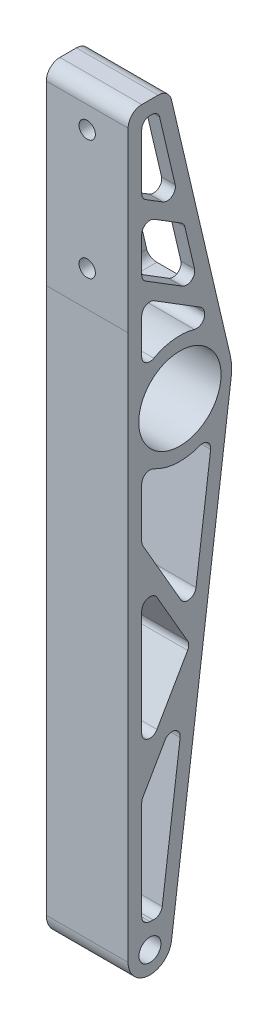
from build123d import *

# Parameters (mm, degrees)
BOSS_EXTRUDE1_DEPTH      = 15
BOSS_EXTRUDE1_DEPTH_BACK = 15
SKETCH1_R                = 4.05
SKETCH1_R_2              = 15.1
CUT_EXTRUDE2_DEPTH       = 10
CUT_EXTRUDE2_DEPTH_BACK  = 10
SKETCH5_W                = 66.834238055
SKETCH5_H                = 69.856255641
CUT_EXTRUDE1_DEPTH       = 274.313007374
CUT_EXTRUDE1_DEPTH_BACK  = 274.313007374
FILLET1_R                = 3
FILLET2_R                = 5
SKETCH6_R                = 3
CUT_EXTRUDE3_DEPTH       = 5


with BuildPart() as part:
    # Sketch1 → Boss-Extrude1 (new, two sides: drawn at the far end of the back side and taken through both)
    with BuildSketch(Plane(origin=(0, 0, 0), x_dir=(0, 0, -1), z_dir=(1, 0, 0)).offset(-BOSS_EXTRUDE1_DEPTH_BACK)):
        with BuildLine():
            Line((-8, 0), (-8, 270))
            Line((-8, 270), (7, 270))
            Line((7, 270), (29.498971947, 173.978261275))
            ThreePointArc((29.498971947, 173.978261275), (29.975942027, 170.599581269), (29.840899654, 167.190073592))
            Line((29.840899654, 167.190073592), (7.933010381, -1.033124533))
            ThreePointArc((7.933010381, -1.033124533), (-0.517647059, -7.983235029), (-8, 0))
        make_face()
        Circle(SKETCH1_R, mode=Mode.SUBTRACT)
        with Locations((11, 169.643744359)):
            Circle(SKETCH1_R_2, mode=Mode.SUBTRACT)
    extrude(amount=BOSS_EXTRUDE1_DEPTH + BOSS_EXTRUDE1_DEPTH_BACK)

    # Sketch5 → Cut-Extrude2 (cut, two sides: drawn at the far end of the back side and taken through both)
    with BuildSketch(Plane(origin=(0, 0, 0), x_dir=(0, 0, -1), z_dir=(1, 0, 0)).offset(-CUT_EXTRUDE2_DEPTH_BACK)):
        with Locations((30.417119028, 230.07187218)):
            Rectangle(SKETCH5_W, SKETCH5_H)
    extrude(amount=CUT_EXTRUDE2_DEPTH + CUT_EXTRUDE2_DEPTH_BACK, mode=Mode.SUBTRACT)

    # Sketch4 → Cut-Extrude1 (cut, two sides: drawn at the far end of the back side and taken through both)
    with BuildSketch(Plane(origin=(15, 0, 0), x_dir=(0, 0, -1), z_dir=(1, 0, 0)).offset(-CUT_EXTRUDE1_DEPTH_BACK)):
        with BuildLine():
            ThreePointArc((23.038271938, 153.672519962), (9.705882353, 149.685656787), (-3, 155.360887501))
            Line((-3, 155.360887501), (-3, 130.360887501))
            Line((-3, 130.360887501), (15.768762187, 97.852437799))
            Line((15.768762187, 97.852437799), (23.038271938, 153.672519962))
        make_face()
        with BuildLine():
            Line((-3, 208.232171682), (-3, 183.926601216))
            ThreePointArc((-3, 183.926601216), (8.703485357, 189.511457375), (21.372438031, 186.743818314))
            Line((21.372438031, 186.743818314), (19.626242772, 194.196279044))
            Line((19.626242772, 194.196279044), (-3, 208.232171682))
        make_face()
        Polygon((14.706143018, 89.692948188), (-3, 120.360887501), (-3, 59.025008875), align=None)
        Polygon((-3, 234.116085841), (-3, 214.116085841), (18.013102612, 201.080883522), (12.529881351, 224.48232784), align=None)
        with BuildLine():
            Line((13.024511965, 76.780277764), (-3, 49.025008875))
            Line((-3, 49.025008875), (-3, 8.485281374))
            ThreePointArc((-3, 8.485281374), (0.582352941, 8.981139407), (4.070672938, 8.026806453))
            Line((4.070672938, 8.026806453), (13.024511965, 76.780277764))
        make_face()
        Polygon((-3, 265), (-3, 240), (10.916741191, 231.366932319), (3.03613565, 265), align=None)
    extrude(amount=CUT_EXTRUDE1_DEPTH + CUT_EXTRUDE1_DEPTH_BACK, mode=Mode.SUBTRACT)

    # Fillet1
    fillet1_edges = [part.edges().sort_by_distance(p)[0] for p in [
        (0, 89.692948188, -14.706143018),
        (0, 59.025008875, 3),
        (0, 120.360887501, 3),
        (12.5, 240, 3),
        (12.5, 265, -3.03613565),
        (12.5, 231.366932319, -10.916741191),
        (-12.5, 240, 3),
        (-12.5, 265, -3.03613565),
        (-12.5, 231.366932319, -10.916741191),
        (0, 183.926601216, 3),
        (12.5, 208.232171682, 3),
        (-12.5, 208.232171682, 3),
        (0, 186.743818314, -21.372438031),
        (0, 194.196279044, -19.626242772),
        (0, 8.026806453, -4.070672938),
        (0, 8.485281374, 3),
        (0, 49.025008875, 3),
        (0, 76.780277764, -13.024511965),
        (12.5, 214.116085841, 3),
        (12.5, 234.116085841, 3),
        (12.5, 224.48232784, -12.529881351),
        (12.5, 201.080883522, -18.013102612),
        (-12.5, 214.116085841, 3),
        (-12.5, 234.116085841, 3),
        (-12.5, 224.48232784, -12.529881351),
        (-12.5, 201.080883522, -18.013102612),
        (0, 155.360887501, 3),
        (0, 153.672519962, -23.038271938),
        (0, 97.852437799, -15.768762187),
        (0, 130.360887501, 3),
        (0, 265, 3),
        (-10, 265, -5.603845906),
        (10, 265, -5.603845906),
        (-10, 195.143744359, -21.319282147),
        (10, 195.143744359, -21.319282147),
    ]]
    fillet(fillet1_edges, radius=FILLET1_R)

    # Fillet2
    fillet2_edges = [part.edges().sort_by_distance(p)[0] for p in [
        (0, 270, 8),
        (0, 270, -7),
    ]]
    fillet(fillet2_edges, radius=FILLET2_R)

    # Sketch6 → Cut-Extrude3 (cut)
    with BuildSketch(Plane.XY.offset(8)):
        with Locations((0, 257)):
            Circle(SKETCH6_R)
        with Locations((0, 213)):
            Circle(SKETCH6_R)
    extrude(amount=-CUT_EXTRUDE3_DEPTH, mode=Mode.SUBTRACT)


solid = part.part
